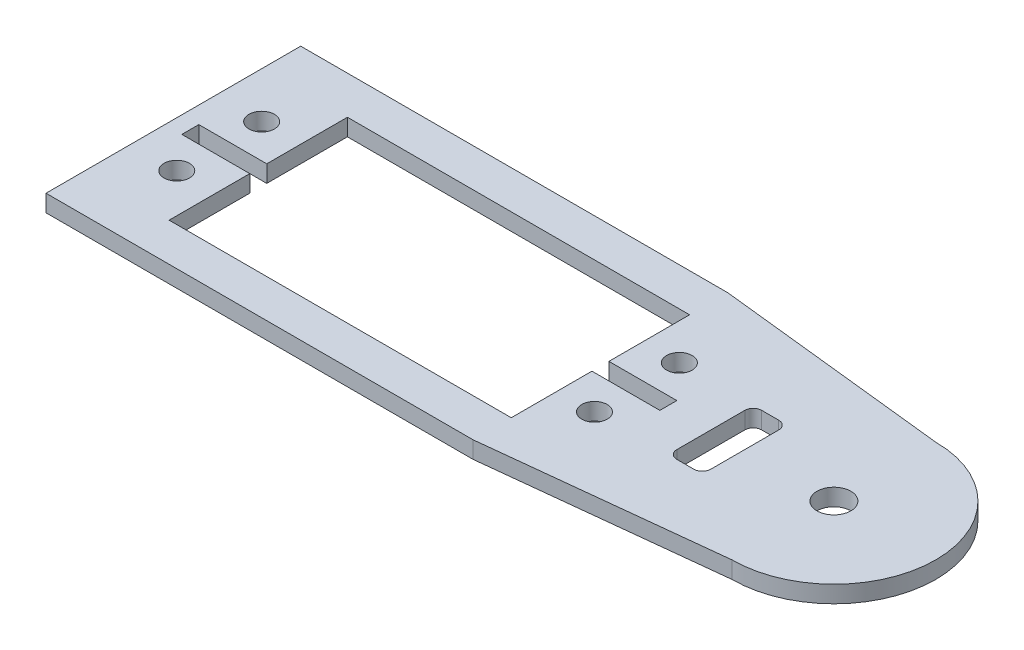
from build123d import *

# Parameters (mm, degrees)
SKETCH_1_R      = 1.5
SKETCH_1_R_2    = 2
SKETCH_1_W      = 4
SKETCH_1_H      = 10
EXTRUDE_1_DEPTH = 2
FILLET_1_R      = 1


with BuildPart() as part:
    # Эскиз1 → Бобышка-Вытянуть1 (new body)
    with BuildSketch(Plane(origin=(0, 0, 0), x_dir=(1, 0, 0), z_dir=(0, 1, 0))):
        with BuildLine():
            Line((-2, 30), (48.3, 30))
            Line((48.3, 30), (75.8, 27))
            ThreePointArc((75.8, 27), (87.8, 15), (75.8, 3))
            Line((75.8, 3), (48.3, 0))
            Line((48.3, 0), (-2, 0))
            Line((-2, 0), (-2, 30))
        make_face()
        with Locations(Location((3.4, 10, 0), (0, 0, 270))):
            Circle(SKETCH_1_R, mode=Mode.SUBTRACT)
        with Locations(Location((3.4, 20, 0), (0, 0, 270))):
            Circle(SKETCH_1_R, mode=Mode.SUBTRACT)
        with Locations(Location((52.6, 10, 0), (0, 0, 270))):
            Circle(SKETCH_1_R, mode=Mode.SUBTRACT)
        with Locations(Location((52.6, 20, 0), (0, 0, 270))):
            Circle(SKETCH_1_R, mode=Mode.SUBTRACT)
        with Locations(Location((75.8, 15, 0), (0, 0, 270))):
            Circle(SKETCH_1_R_2, mode=Mode.SUBTRACT)
        Polygon((8, 25.5), (48.3, 25.5), (48.3, 16), (56.3, 16), (56.3, 14), (48.3, 14), (48.3, 4.5), (8, 4.5), (8, 14), (0, 14), (0, 16), (8, 16), align=None, mode=Mode.SUBTRACT)
        with Locations((63.3, 15)):
            Rectangle(SKETCH_1_W, SKETCH_1_H, mode=Mode.SUBTRACT)
    extrude(amount=EXTRUDE_1_DEPTH)

    # Скругление1
    fillet_1_edges = [part.edges().sort_by_distance(p)[0] for p in [
        (65.3, 1, -10),
        (65.3, 1, -20),
        (61.3, 1, -20),
        (61.3, 1, -10),
    ]]
    fillet(fillet_1_edges, radius=FILLET_1_R)


solid = part.part
